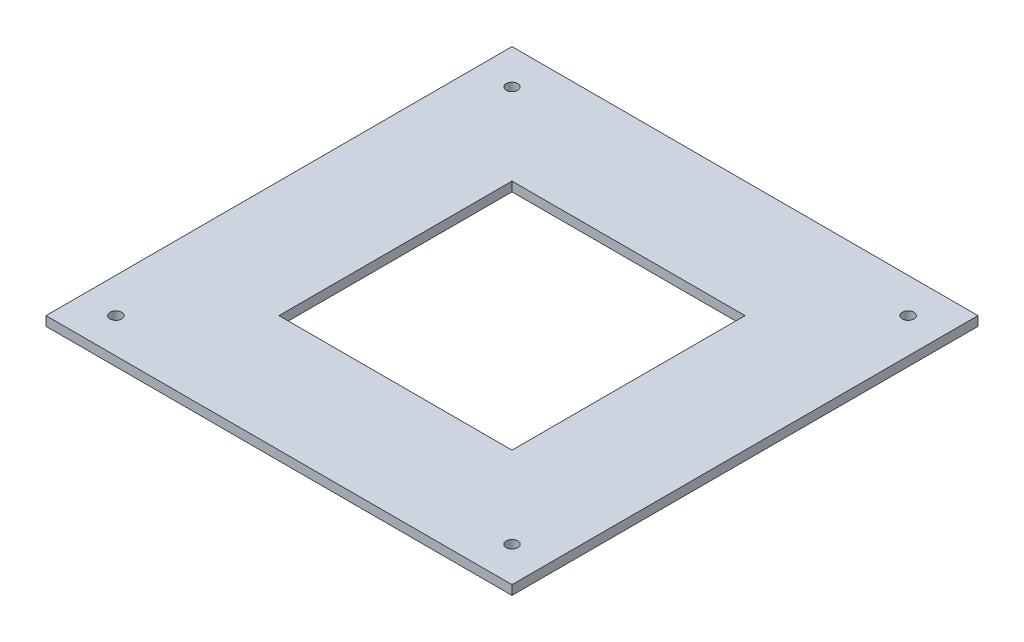
from build123d import *

# Parameters (mm, degrees)
CROQUIS1_W              = 200
CROQUIS1_H              = 200
CROQUIS1_R              = 2.5
SALIENTE_EXTRUIR1_DEPTH = 4
CROQUIS2_W              = 100
CROQUIS2_H              = 100
CORTAR_EXTRUIR1_DEPTH   = 4


with BuildPart() as part:
    # Croquis1 → Saliente-Extruir1 (new body)
    with BuildSketch(Plane(origin=(0, 0, 0), x_dir=(1, 0, 0), z_dir=(0, 1, 0))):
        with Locations((100, 100)):
            Rectangle(CROQUIS1_W, CROQUIS1_H)
        with Locations(Location((15, 185, 0), (0, 0, 270))):
            Circle(CROQUIS1_R, mode=Mode.SUBTRACT)
        with Locations(Location((185, 185, 0), (0, 0, 270))):
            Circle(CROQUIS1_R, mode=Mode.SUBTRACT)
        with Locations(Location((185, 15, 0), (0, 0, 270))):
            Circle(CROQUIS1_R, mode=Mode.SUBTRACT)
        with Locations(Location((15, 15, 0), (0, 0, 270))):
            Circle(CROQUIS1_R, mode=Mode.SUBTRACT)
    extrude(amount=SALIENTE_EXTRUIR1_DEPTH)

    # Croquis2 → Cortar-Extruir1 (cut)
    with BuildSketch(Plane(origin=(0, 4, 0), x_dir=(1, 0, 0), z_dir=(0, 1, 0))):
        with Locations((100, 100)):
            Rectangle(CROQUIS2_W, CROQUIS2_H)
    extrude(amount=-CORTAR_EXTRUIR1_DEPTH, mode=Mode.SUBTRACT)


solid = part.part
